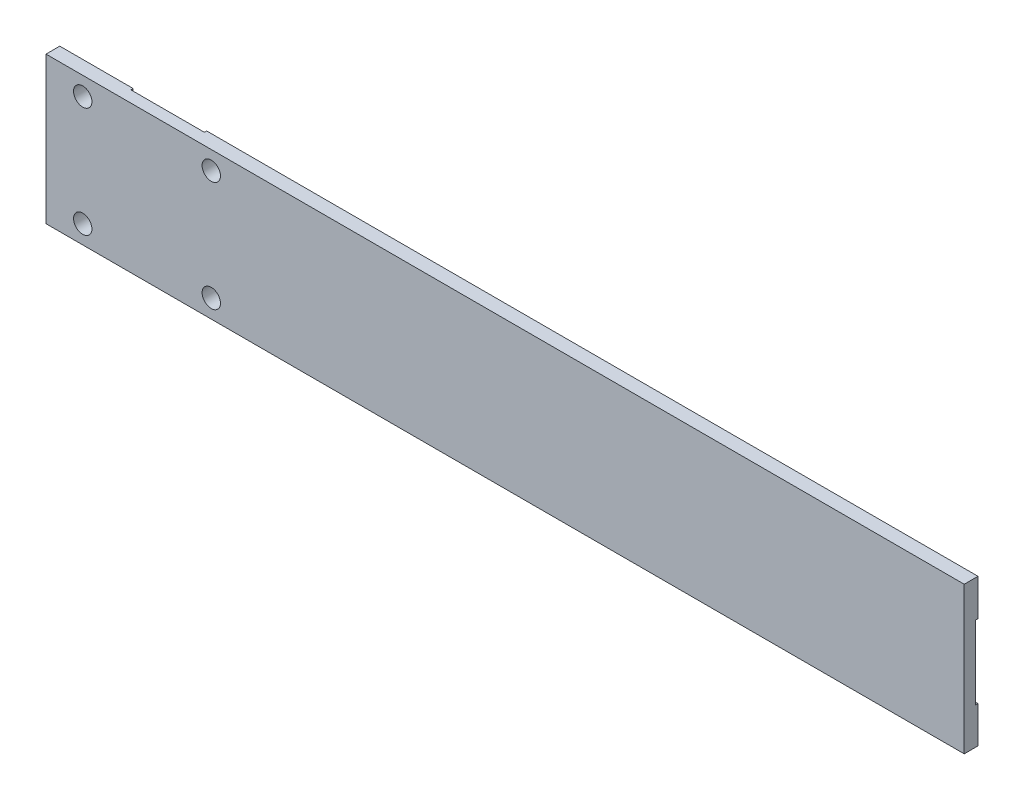
from build123d import *

# Parameters (mm, degrees)
SKETCH1_W               = 635
SKETCH1_H               = 101.6
BOSS_EXTRUDE1_DEPTH     = 9.525
CUT_EXTRUDE1_DEPTH      = 644.147172601
CUT_EXTRUDE1_DEPTH_BACK = 9.525
CUT_EXTRUDE1_START      = 60.325
SKETCH2_W               = 1.5875
SKETCH2_H               = 50.8
CUT_EXTRUDE4_DEPTH      = 644.147172601
CUT_EXTRUDE4_DEPTH_BACK = 644.147172601
SKETCH3_R               = 6.35
SKETCH5_W               = 50.8
SKETCH5_H               = 101.6
CUT_EXTRUDE5_DEPTH      = 1.5875


with BuildPart() as part:
    # Sketch1 → Boss-Extrude1 (new body)
    with BuildSketch(Plane.XY):
        with Locations((317.5, 50.8)):
            Rectangle(SKETCH1_W, SKETCH1_H)
    extrude(amount=BOSS_EXTRUDE1_DEPTH)

    # Sketch2 → Cut-Extrude1 (cut, two sides: drawn at the far end of the back side and taken through both)
    with BuildSketch(Plane(origin=(0, 0, 0), x_dir=(0, 0, -1), z_dir=(1, 0, 0)).offset(CUT_EXTRUDE1_START - CUT_EXTRUDE1_DEPTH_BACK)):
        with Locations((-0.79375, 50.8)):
            Rectangle(SKETCH2_W, SKETCH2_H)
    extrude(amount=CUT_EXTRUDE1_DEPTH + CUT_EXTRUDE1_DEPTH_BACK, mode=Mode.SUBTRACT)

    # Sketch3 → Cut-Extrude4 (cut, two sides: drawn at the far end of the back side and taken through both)
    with BuildSketch(Plane(origin=(0, 0, 0), x_dir=(-1, 0, 0), z_dir=(0, 0, -1)).offset(-CUT_EXTRUDE4_DEPTH_BACK)):
        with Locations((-25.4, 88.9)):
            Circle(SKETCH3_R)
        with Locations((-114.3, 88.9)):
            Circle(SKETCH3_R)
        with Locations((-114.3, 12.7)):
            Circle(SKETCH3_R)
        with Locations((-25.4, 12.7)):
            Circle(SKETCH3_R)
    extrude(amount=CUT_EXTRUDE4_DEPTH + CUT_EXTRUDE4_DEPTH_BACK, mode=Mode.SUBTRACT)

    # Sketch5 → Cut-Extrude5 (cut)
    with BuildSketch(Plane(origin=(0, 0, 0), x_dir=(-1, 0, 0), z_dir=(0, 0, -1))):
        with Locations((-76.2, 50.8)):
            Rectangle(SKETCH5_W, SKETCH5_H)
    extrude(amount=-CUT_EXTRUDE5_DEPTH, mode=Mode.SUBTRACT)


solid = part.part
